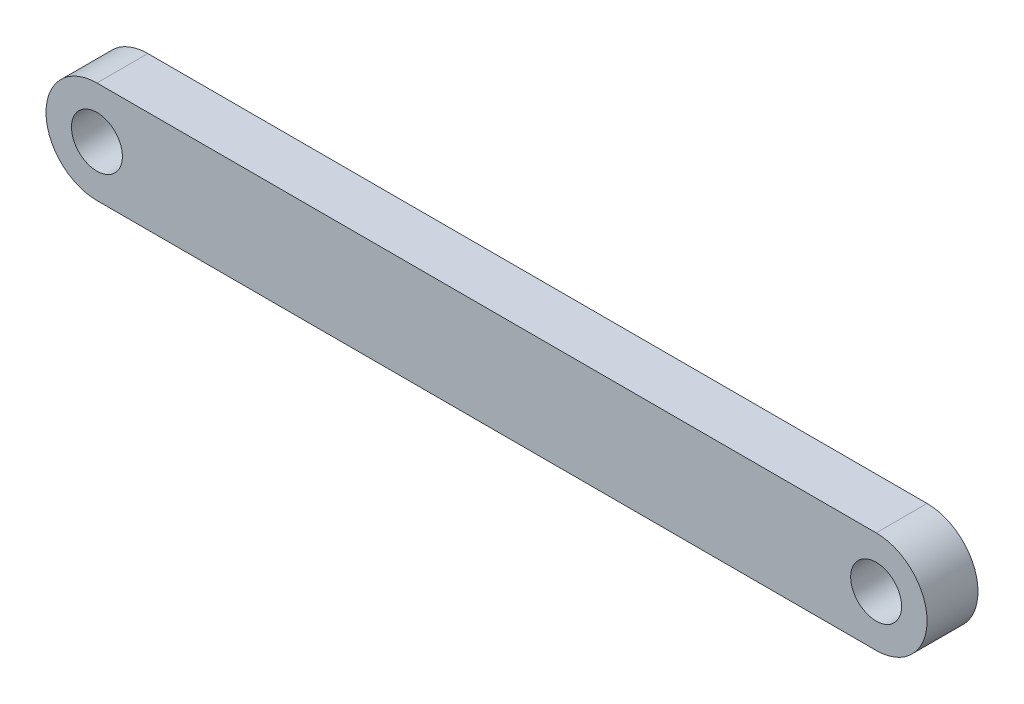
from build123d import *

# Parameters (mm, degrees)
SKETCH_1_R      = 5
EXTRUDE_1_DEPTH = 10


with BuildPart() as part:
    # 草图1 → 凸台-拉伸1 (new body)
    with BuildSketch(Plane.XY):
        with BuildLine():
            Line((0, 10), (153, 10))
            ThreePointArc((153, 10), (163, 0), (153, -10))
            Line((153, -10), (0, -10))
            ThreePointArc((0, -10), (-10, 0), (0, 10))
        make_face()
        Circle(SKETCH_1_R, mode=Mode.SUBTRACT)
        with Locations((153, 0)):
            Circle(SKETCH_1_R, mode=Mode.SUBTRACT)
    extrude(amount=EXTRUDE_1_DEPTH)


solid = part.part
